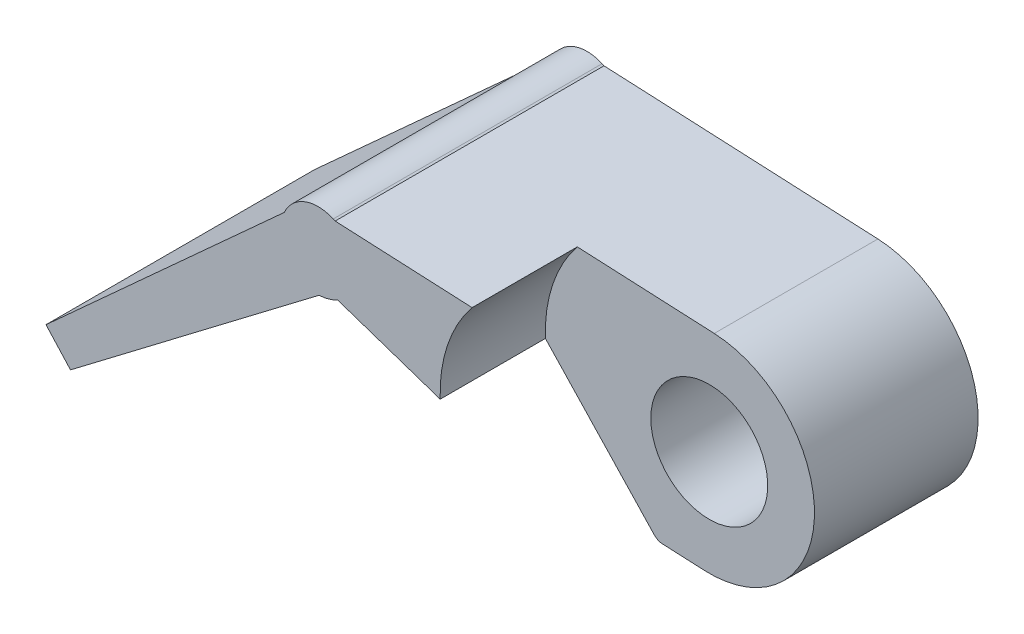
from build123d import *

# Parameters (mm, degrees)
BOSS_EXTRUDE1_DEPTH = 23
SKETCH4_R           = 5
CUT_EXTRUDE3_DEPTH  = 28
CUT_EXTRUDE6_START  = -9
CUT_EXTRUDE6_DEPTH  = 9


with BuildPart() as part:
    # Sketch1 → Boss-Extrude1 (new body)
    with BuildSketch(Plane.XY):
        with BuildLine():
            Line((-26.278110913, -11.347842937), (-28.372166089, -9.043842083))
            Line((-28.372166089, -9.043842083), (-7.990208081, 9.462215656))
            ThreePointArc((-7.990208081, 9.462215656), (-6.229501786, 11.136017118), (-3.800938061, 11.07456612))
            Line((-3.800938061, 11.07456612), (-3.637536714, 11.001987755))
            Line((-3.637536714, 11.001987755), (19.793985679, 9.88969345))
            ThreePointArc((19.793985679, 9.88969345), (28.356197765, 0.474073738), (18.940578052, -8.088138348))
            Line((18.940578052, -8.088138348), (15.348738563, -7.91649311))
            ThreePointArc((15.348738563, -7.91649311), (14.978028358, -7.825889172), (14.668239185, -7.603030926))
            Line((14.668239185, -7.603030926), (5.35012395, 2.296550983))
            Line((5.35012395, 2.296550983), (-3.419163159, 5.255947346))
            ThreePointArc((-3.419163159, 5.255947346), (-4.191805611, 4.94513719), (-5.014133862, 4.813396687))
            Line((-5.014133862, 4.813396687), (-26.278110913, -11.347842937))
        make_face()
    extrude(amount=BOSS_EXTRUDE1_DEPTH)

    # Sketch4 → Cut-Extrude3 (cut)
    with BuildSketch(Plane(origin=(0, 0, 0), x_dir=(-1, 0, 0), z_dir=(0, 0, -1))):
        with Locations((-19.367281866, 0.900777551)):
            Circle(SKETCH4_R)
    extrude(amount=-CUT_EXTRUDE3_DEPTH, mode=Mode.SUBTRACT)

    # Sketch5 → Cut-Extrude6 (cut)
    with BuildSketch(Plane.XY.offset(23).offset(CUT_EXTRUDE6_START)):
        with BuildLine():
            Line((8.078224483, 10.445840603), (19.793985679, 9.88969345))
            ThreePointArc((19.793985679, 9.88969345), (28.356197765, 0.474073738), (18.940578052, -8.088138348))
            Line((18.940578052, -8.088138348), (15.348738563, -7.91649311))
            ThreePointArc((15.348738563, -7.91649311), (14.978028358, -7.825889172), (14.668239185, -7.603030926))
            Line((14.668239185, -7.603030926), (5.35012395, 2.296550983))
            ThreePointArc((5.35012395, 2.296550983), (5.975547098, 6.618462626), (8.078224483, 10.445840603))
        make_face()
    extrude(amount=CUT_EXTRUDE6_DEPTH, mode=Mode.SUBTRACT)


solid = part.part
